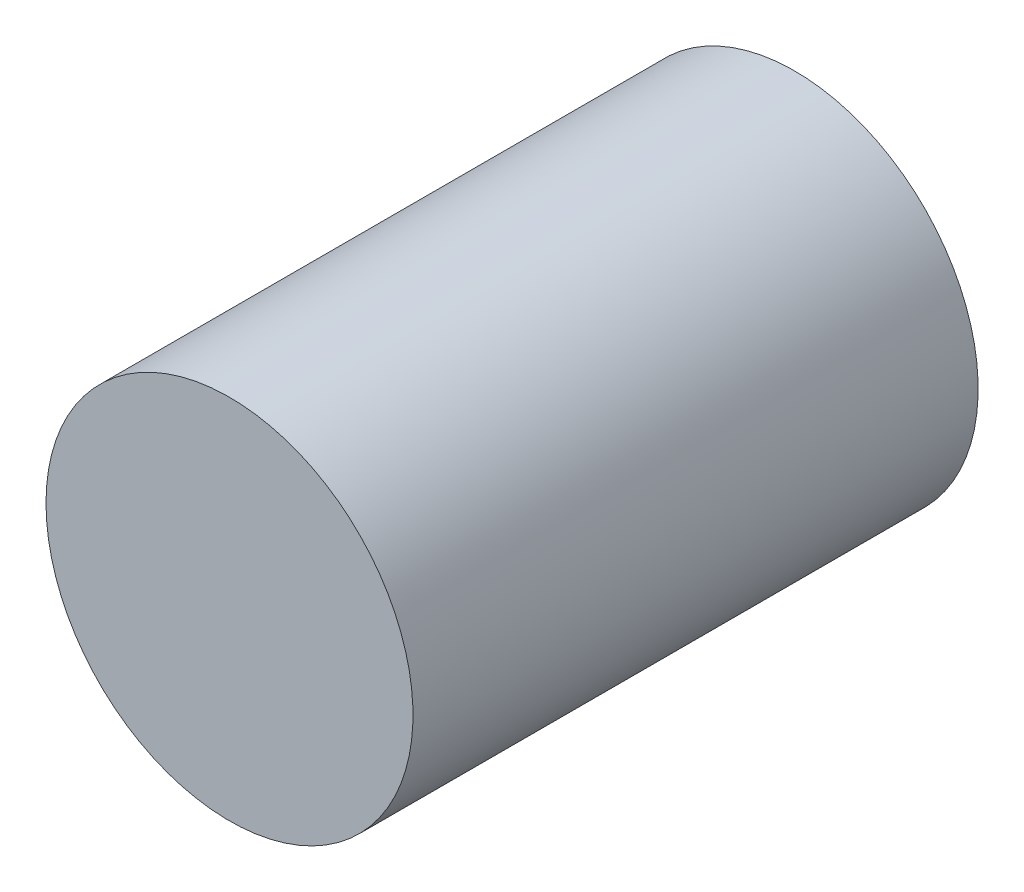
from build123d import *


with BuildPart() as part:
    # Sketch1 → Revolve1 (revolve)
    with BuildSketch(Plane(origin=(0, 0, 0), x_dir=(1, 0, 0), z_dir=(0, 1, 0))):
        Polygon((0, 73.036612013), (0, 41.036612013), (-9.5, 41.036612013), (-9.5, 38.036612013), (-20, 38.036612013), (-20, 8.036612013), (-9.5, 8.036612013), (-9.5, 5.036612013), (0, 5.036612013), (0, -26.963387987), (-32.466551858, -26.963387987), (-32.466551858, 73.036612013), align=None)
    revolve(axis=Axis((0, 0, -5.036612013), (0, 0, 1)))


solid = part.part
